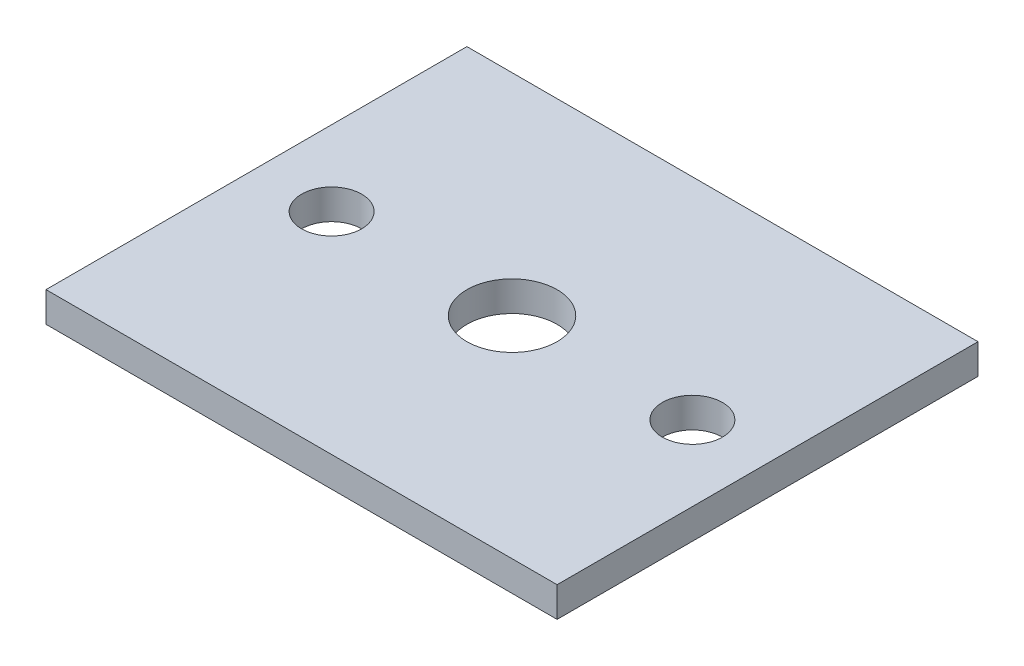
from build123d import *

# Parameters (mm, degrees)
SKETCH1_W           = 170
SKETCH1_H           = 140
BOSS_EXTRUDE1_DEPTH = 10
SKETCH2_R           = 10
SKETCH2_R_2         = 15
CUT_EXTRUDE1_DEPTH  = 221.45407685


with BuildPart() as part:
    # Sketch1 → Boss-Extrude1 (new body)
    with BuildSketch(Plane(origin=(0, 0, 0), x_dir=(1, 0, 0), z_dir=(0, 1, 0))):
        with Locations((85, 70)):
            Rectangle(SKETCH1_W, SKETCH1_H)
    extrude(amount=BOSS_EXTRUDE1_DEPTH)

    # Sketch2 → Cut-Extrude1 (cut, through all)
    with BuildSketch(Plane(origin=(0, 10, 0), x_dir=(1, 0, 0), z_dir=(0, 1, 0))):
        with Locations(Location((25, 70, 0), (0, 0, 270))):
            Circle(SKETCH2_R)
        with Locations(Location((145, 70, 0), (0, 0, 270))):
            Circle(SKETCH2_R)
        with Locations(Location((85, 70, 0), (0, 0, 270))):
            Circle(SKETCH2_R_2)
    extrude(amount=-CUT_EXTRUDE1_DEPTH, mode=Mode.SUBTRACT)


solid = part.part
